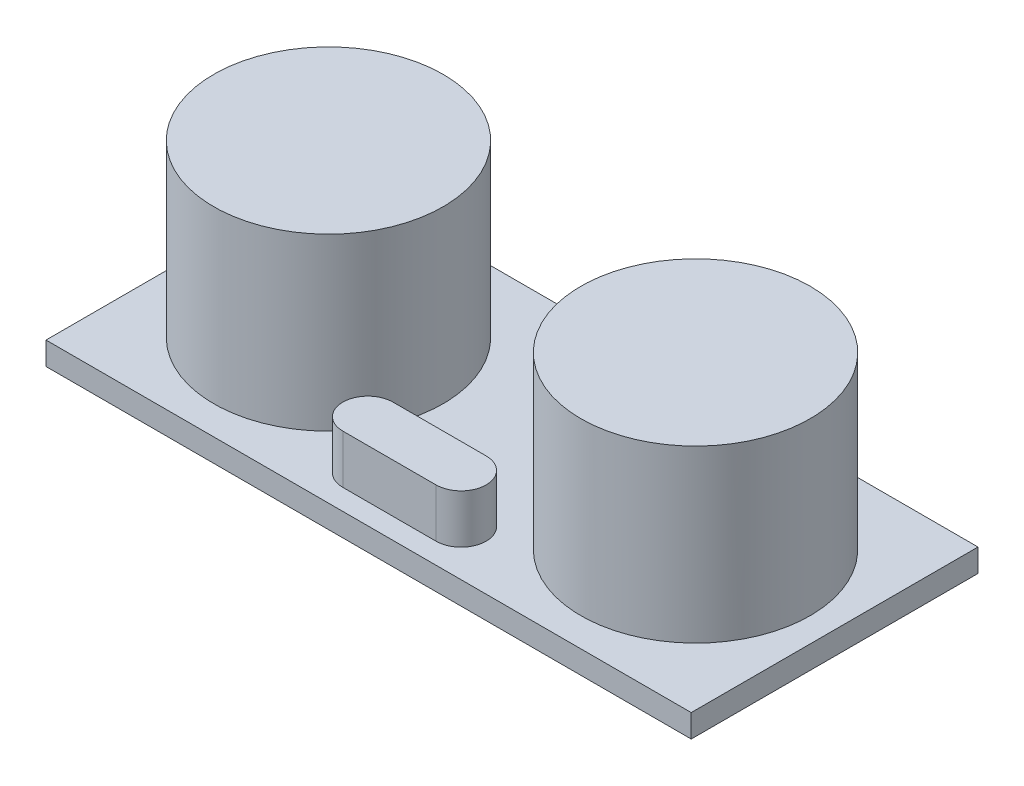
from build123d import *

# Parameters (mm, degrees)
SKETCH_1_W      = 45
SKETCH_1_H      = 20
EXTRUDE_1_DEPTH = 1.6
SKETCH_2_R      = 8
EXTRUDE_2_DEPTH = 11.9
EXTRUDE_3_DEPTH = 3.4
SKETCH_4_W      = 10
SKETCH_4_H      = 2.5
EXTRUDE_4_DEPTH = 10


with BuildPart() as part:
    # 草图1 → 凸台-拉伸1 (new body)
    with BuildSketch(Plane(origin=(0, 0, 0), x_dir=(1, 0, 0), z_dir=(0, 1, 0))):
        Rectangle(SKETCH_1_W, SKETCH_1_H)
    extrude(amount=EXTRUDE_1_DEPTH)

    # 草图2 → 凸台-拉伸2 (add)
    with BuildSketch(Plane(origin=(0, 1.6, 0), x_dir=(1, 0, 0), z_dir=(0, 1, 0))):
        with Locations(Location((12.8, 0, 0), (0, 0, 90))):
            Circle(SKETCH_2_R)
        with Locations(Location((-12.8, 0, 0), (0, 0, 90))):
            Circle(SKETCH_2_R)
    extrude(amount=EXTRUDE_2_DEPTH)

    # 草图3 → 凸台-拉伸3 (add)
    with BuildSketch(Plane(origin=(0, 1.6, 0), x_dir=(1, 0, 0), z_dir=(0, 1, 0))):
        with BuildLine():
            Line((-3.25, -5.048754616), (3.25, -5.048754616))
            ThreePointArc((3.25, -5.048754616), (5, -6.798754616), (3.25, -8.548754616))
            Line((3.25, -8.548754616), (-3.25, -8.548754616))
            ThreePointArc((-3.25, -8.548754616), (-5, -6.798754616), (-3.25, -5.048754616))
        make_face()
    extrude(amount=EXTRUDE_3_DEPTH)

    # 草图4 → 凸台-拉伸4 (add)
    with BuildSketch(Plane.XZ):
        with Locations((0, -8.75)):
            Rectangle(SKETCH_4_W, SKETCH_4_H)
    extrude(amount=EXTRUDE_4_DEPTH)


solid = part.part
